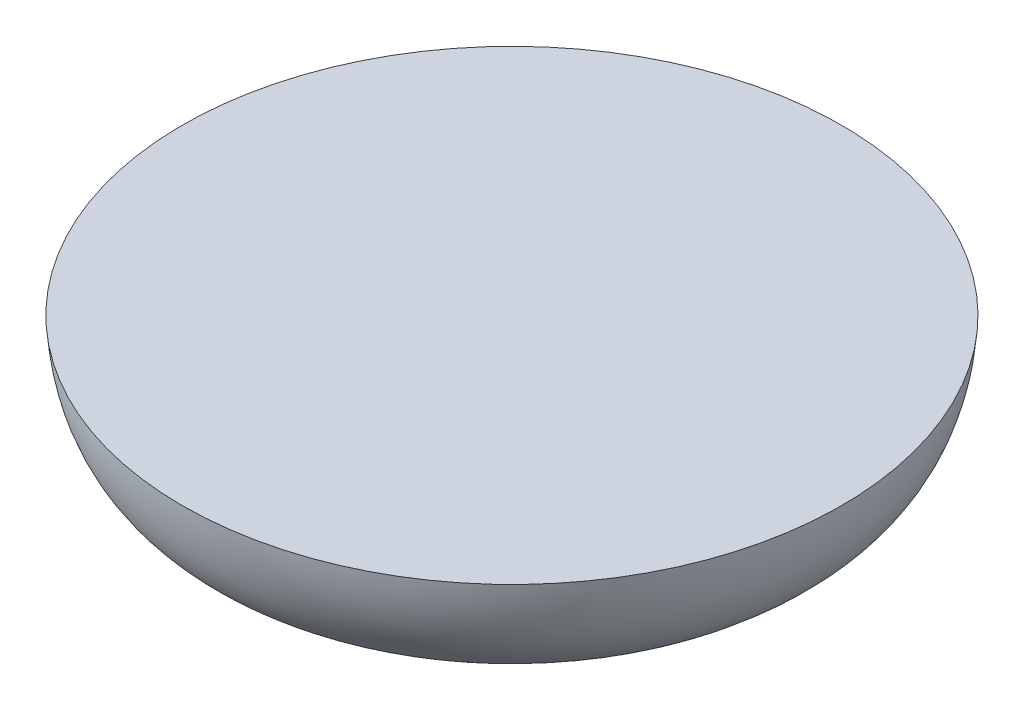
from build123d import *

# Parameters (mm, degrees)
SCALE1_SCALE = 1.05


with BuildPart() as part:
    # Sketch1 → Revolve1 (revolve)
    with BuildSketch(Plane.XY):
        with BuildLine():
            Line((-8.5, -4.112917186), (-13.491490452, -4.112917186))
            add(Edge.make_bspline(
                [(-24.1, 5.207082814), (-23.403193184, -4.314773899), (-13.491490452, -4.112917186)],
                knots=[0, 0, 0, 1, 1, 1], degree=2))
            Line((-24.1, 5.207082814), (0, 5.207082814))
            Line((0, 5.207082814), (0, -5.792917186))
            Line((0, -5.792917186), (-8.5, -5.792917186))
            Line((-8.5, -5.792917186), (-8.5, -4.112917186))
        make_face()
    revolve(axis=Axis((0, 24.52235385, 0), (0, -1, 0)))


with BuildPart() as part_1:
    # Scale1: scaled about (0, 0.820760577, 0)
    add(part.part.scale(SCALE1_SCALE).moved(Location((0, -0.041038029, 0))))


solid = part_1.part
